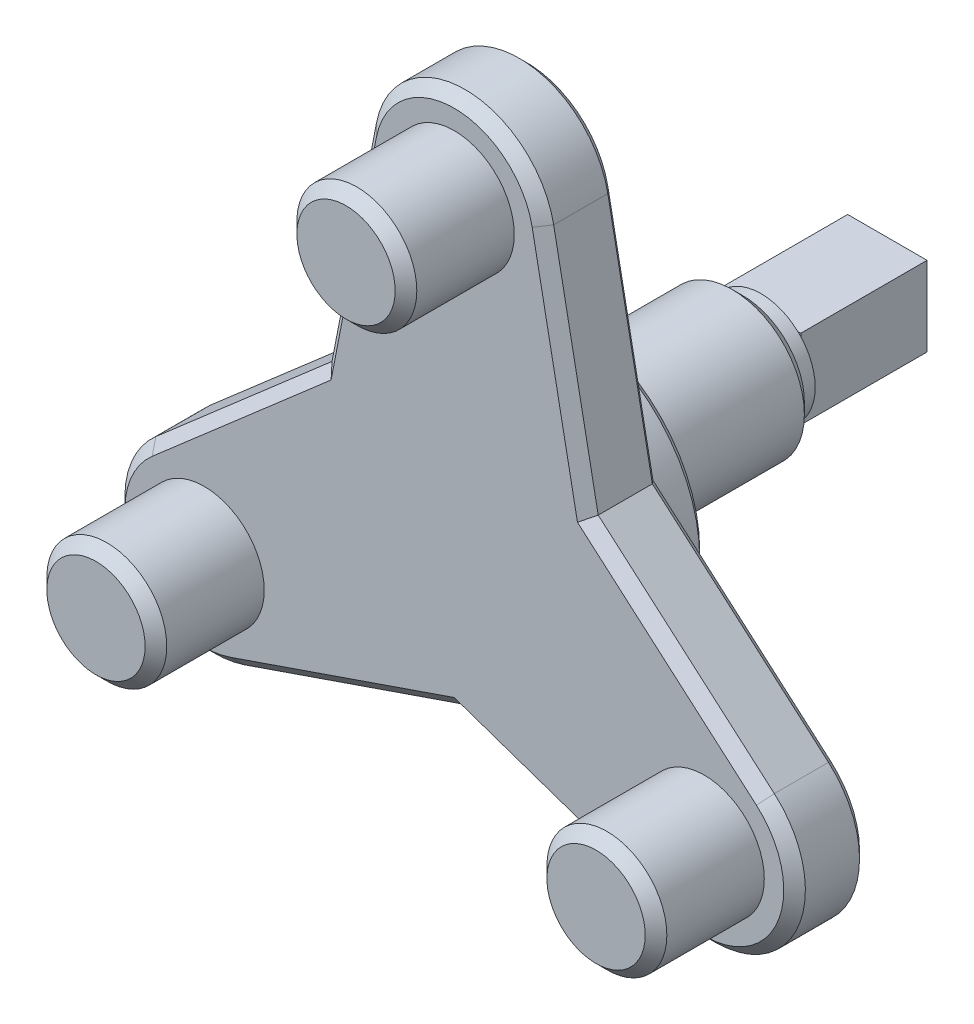
from build123d import *

# Parameters (mm, degrees)
SCHIZZO1_W                   = 2.2
SCHIZZO1_H                   = 2.2
ESTRUSIONE_ESTRUSIONE1_DEPTH = 3.5
SCHIZZO2_R                   = 1.5
ESTRUSIONE_ESTRUSIONE2_DEPTH = 0.5
SCHIZZO3_R                   = 2
ESTRUSIONE_ESTRUSIONE3_DEPTH = 5
SCHIZZO4_R                   = 4
ESTRUSIONE_ESTRUSIONE4_DEPTH = 1
ESTRUSIONE_ESTRUSIONE7_DEPTH = 2
SCHIZZO12_R                  = 1.66147464
ESTRUSIONE_ESTRUSIONE8_DEPTH = 3
SMUSSO4_SIZE                 = 0.2
SMUSSO5_SIZE                 = 0.3


with BuildPart() as part:
    # Schizzo1 → Estrusione-Estrusione1 (new body)
    with BuildSketch(Plane.XY):
        Rectangle(SCHIZZO1_W, SCHIZZO1_H)
    extrude(amount=ESTRUSIONE_ESTRUSIONE1_DEPTH)

    # Schizzo2 → Estrusione-Estrusione2 (add)
    with BuildSketch(Plane.XY.offset(3.5)):
        with Locations(Location((0, 0, 0), (0, 0, 137.166571934))):
            Circle(SCHIZZO2_R)
    extrude(amount=ESTRUSIONE_ESTRUSIONE2_DEPTH)

    # Schizzo3 → Estrusione-Estrusione3 (add)
    with BuildSketch(Plane.XY.offset(4)):
        Circle(SCHIZZO3_R)
    extrude(amount=ESTRUSIONE_ESTRUSIONE3_DEPTH)

    # Schizzo4 → Estrusione-Estrusione4 (add)
    with BuildSketch(Plane.XY.offset(9)):
        Circle(SCHIZZO4_R)
    extrude(amount=ESTRUSIONE_ESTRUSIONE4_DEPTH)

    # Schizzo11 → Estrusione-Estrusione7 (add)
    with BuildSketch(Plane.XY.offset(10)):
        with BuildLine():
            Line((-3.687951879, 2.12924001), (-2.454067959, 8.477022488))
            ThreePointArc((-2.454067959, 8.477022488), (0, 10.5), (2.454067959, 8.477022488))
            Line((2.454067959, 8.477022488), (3.687951879, 2.12924001))
            Line((3.687951879, 2.12924001), (8.568350803, -2.113226049))
            ThreePointArc((8.568350803, -2.113226049), (9.09326674, -5.25), (6.114282844, -6.363796439))
            Line((6.114282844, -6.363796439), (0, -4.25848002))
            Line((0, -4.25848002), (-6.114282844, -6.363796439))
            ThreePointArc((-6.114282844, -6.363796439), (-9.09326674, -5.25), (-8.568350803, -2.113226049))
            Line((-8.568350803, -2.113226049), (-3.687951879, 2.12924001))
        make_face()
    extrude(amount=ESTRUSIONE_ESTRUSIONE7_DEPTH)

    # Schizzo12 → Estrusione-Estrusione8 (add)
    with BuildSketch(Plane.XY.offset(12)):
        with Locations((0, 8)):
            Circle(SCHIZZO12_R)
        with Locations((6.92820323, -4)):
            Circle(SCHIZZO12_R)
        with Locations((-6.92820323, -4)):
            Circle(SCHIZZO12_R)
    extrude(amount=ESTRUSIONE_ESTRUSIONE8_DEPTH)

    # Smusso4
    smusso4_edges = [part.edges().sort_by_distance(p)[0] for p in [
        (-4, 0, 9),
        (-6.128151341, 0.00800698, 10),
        (-9.09326674, -5.25, 10),
        (-3.057141422, -5.31113823, 10),
        (3.057141422, -5.31113823, 10),
        (9.09326674, -5.25, 10),
        (6.128151341, 0.00800698, 10),
        (3.071009919, 5.303131249, 10),
        (0, 10.5, 10),
        (-3.071009919, 5.303131249, 10),
    ]]
    chamfer(smusso4_edges, length=SMUSSO4_SIZE)

    # Smusso5
    smusso5_edges = [part.edges().sort_by_distance(p)[0] for p in [
        (-2, 0, 4),
        (-6.128151341, 0.00800698, 12),
        (-9.09326674, -5.25, 12),
        (-3.057141422, -5.31113823, 12),
        (3.057141422, -5.31113823, 12),
        (9.09326674, -5.25, 12),
        (6.128151341, 0.00800698, 12),
        (3.071009919, 5.303131249, 12),
        (0, 10.5, 12),
        (-3.071009919, 5.303131249, 12),
        (-1.66147464, 8, 15),
        (5.266728591, -4, 15),
        (-8.58967787, -4, 15),
    ]]
    chamfer(smusso5_edges, length=SMUSSO5_SIZE)


solid = part.part
